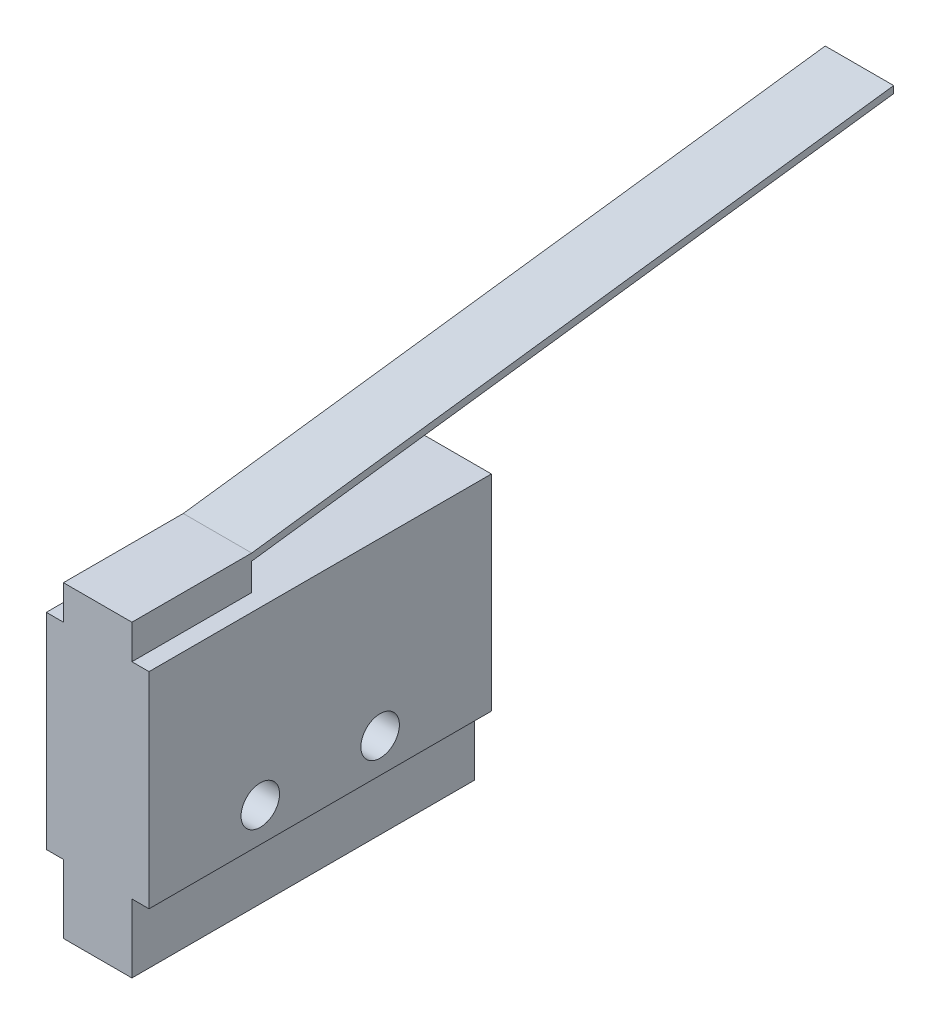
from build123d import *

# Parameters (mm, degrees)
SKETCH1_W           = 6
SKETCH1_H           = 20
BOSS_EXTRUDE1_DEPTH = 10
SKETCH3_W           = 6
SKETCH3_H           = 20
BOSS_EXTRUDE2_DEPTH = 2
SKETCH2_R           = 1.125
CUT_EXTRUDE1_DEPTH  = 7
SKETCH4_W           = 4
SKETCH4_H           = 20
BOSS_EXTRUDE3_DEPTH = 4
SKETCH5_W           = 4
SKETCH5_H           = 7
BOSS_EXTRUDE4_DEPTH = 2
BOSS_EXTRUDE5_DEPTH = 4


with BuildPart() as part:
    # Sketch1 → Boss-Extrude1 (new body)
    with BuildSketch(Plane(origin=(0, 0, 0), x_dir=(1, 0, 0), z_dir=(0, 1, 0))):
        with Locations((3, 10)):
            Rectangle(SKETCH1_W, SKETCH1_H)
    extrude(amount=BOSS_EXTRUDE1_DEPTH)

    # Sketch3 → Boss-Extrude2 (add)
    with BuildSketch(Plane(origin=(0, 0, 0), x_dir=(-1, 0, 0), z_dir=(0, -1, 0))):
        with Locations((-3, 10)):
            Rectangle(SKETCH3_W, SKETCH3_H)
    extrude(amount=BOSS_EXTRUDE2_DEPTH)

    # Sketch2 → Cut-Extrude1 (cut)
    with BuildSketch(Plane(origin=(6, 0, 0), x_dir=(0, 0, -1), z_dir=(1, 0, 0))):
        with Locations((6.5, 0)):
            Circle(SKETCH2_R)
        with Locations((13.5, 0)):
            Circle(SKETCH2_R)
    extrude(amount=-CUT_EXTRUDE1_DEPTH, mode=Mode.SUBTRACT)

    # Sketch4 → Boss-Extrude3 (add)
    with BuildSketch(Plane(origin=(0, -2, 0), x_dir=(-1, 0, 0), z_dir=(0, -1, 0))):
        with Locations((-3, 10)):
            Rectangle(SKETCH4_W, SKETCH4_H)
    extrude(amount=BOSS_EXTRUDE3_DEPTH)

    # Sketch5 → Boss-Extrude4 (add)
    with BuildSketch(Plane(origin=(0, 10, 0), x_dir=(1, 0, 0), z_dir=(0, 1, 0))):
        with Locations((3, 3.5)):
            Rectangle(SKETCH5_W, SKETCH5_H)
    extrude(amount=BOSS_EXTRUDE4_DEPTH)

    # Sketch7 → Boss-Extrude5 (add)
    with BuildSketch(Plane(origin=(5, 0, 0), x_dir=(0, 0, -1), z_dir=(1, 0, 0))):
        Polygon((7, 12), (44.5, 16.9), (44.5, 16.491160733), (7, 11.591160733), (7, 10), (0, 10), (0, 12), align=None)
    extrude(amount=-BOSS_EXTRUDE5_DEPTH)


solid = part.part
